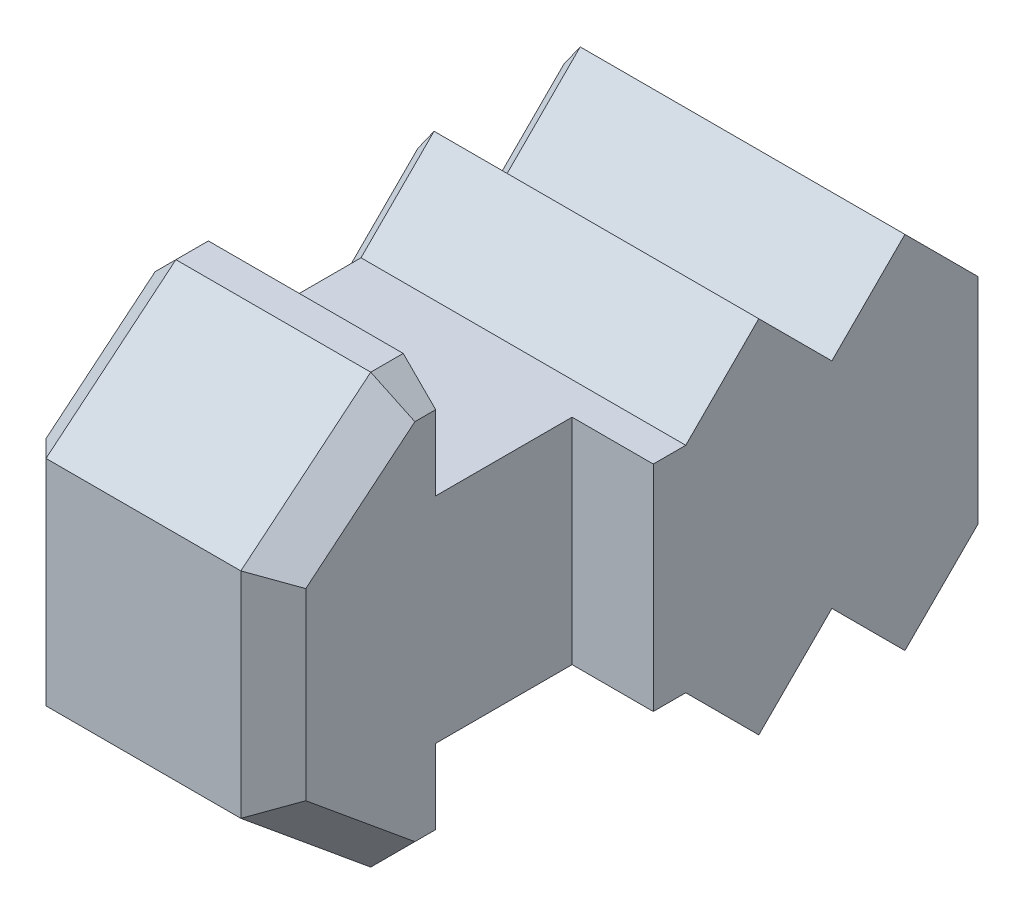
from build123d import *

# Parameters (mm, degrees)
BOSS_EXTRUDE1_DEPTH      = 4
BOSS_EXTRUDE1_DEPTH_BACK = 4
BOSS_EXTRUDE2_DEPTH      = 2.5
CHAMFER1_SIZE            = 1
CUT_EXTRUDE1_DEPTH       = 8.5
CHAMFER2_SIZE            = 0.5


with BuildPart() as part:
    # Sketch1 → Boss-Extrude1 (new, two sides: drawn at the far end of the back side and taken through both)
    with BuildSketch(Plane.YZ.offset(-BOSS_EXTRUDE1_DEPTH_BACK)):
        Polygon((-3.3, 9.2), (3.3, 9.2), (6.6, 5.2), (6.6, 4.2), (3.3, 4.2), (3.3, 0), (3.3, -1), (5.55, -3.25), (3.3, -5.5), (5.55, -7.75), (3.3, -10), (-3.3, -10), (-5.55, -7.75), (-3.3, -5.5), (-5.55, -3.25), (-3.3, -1), (-3.3, 0), (-3.3, 4.2), (-6.6, 4.2), (-6.6, 5.2), align=None)
    extrude(amount=BOSS_EXTRUDE1_DEPTH + BOSS_EXTRUDE1_DEPTH_BACK)

    # Sketch2 → Boss-Extrude2 (add)
    with BuildSketch(Plane.YZ.offset(4)):
        Polygon((-3.3, 0), (3.3, 0), (3.3, -1), (5.55, -3.25), (3.3, -5.5), (5.55, -7.75), (3.3, -10), (-3.3, -10), (-5.55, -7.75), (-3.3, -5.5), (-5.55, -3.25), (-3.3, -1), align=None)
    extrude(amount=BOSS_EXTRUDE2_DEPTH)

    # Chamfer1
    chamfer1_edges = [part.edges().sort_by_distance(p)[0] for p in [
        (-4, -4.95, 7.2),
        (-4, -6.6, 4.7),
        (-4, 4.95, 7.2),
        (4, 4.95, 7.2),
        (4, 0, 9.2),
        (4, -4.95, 7.2),
        (4, -6.6, 4.7),
        (4, 6.6, 4.7),
        (-4, 6.6, 4.7),
        (-4, 0, 9.2),
    ]]
    chamfer(chamfer1_edges, length=CHAMFER1_SIZE)

    # Sketch3 → Cut-Extrude1 (cut)
    with BuildSketch(Plane(origin=(-4, 0, 0), x_dir=(0, -1, 0), z_dir=(-1, 0, 0))):
        Polygon((0, -8), (2, -10), (-2, -10), align=None)
    extrude(amount=-CUT_EXTRUDE1_DEPTH, mode=Mode.SUBTRACT)

    # Chamfer2
    chamfer2_edges = [part.edges().sort_by_distance(p)[0] for p in [
        (-4, 2.65, -10),
        (-4, 1, -9),
        (-4, -1, -9),
        (-4, -3.3, 1.6),
        (-4, -4.425, -2.125),
        (-4, -4.425, -4.375),
        (-4, -4.425, -6.625),
        (-4, -4.425, -8.875),
        (-4, -2.65, -10),
        (-4, 4.425, -8.875),
        (-4, 4.425, -6.625),
        (-4, 4.425, -4.375),
        (-4, 4.425, -2.125),
        (-4, 3.3, 1.6),
    ]]
    chamfer(chamfer2_edges, length=CHAMFER2_SIZE)


solid = part.part
